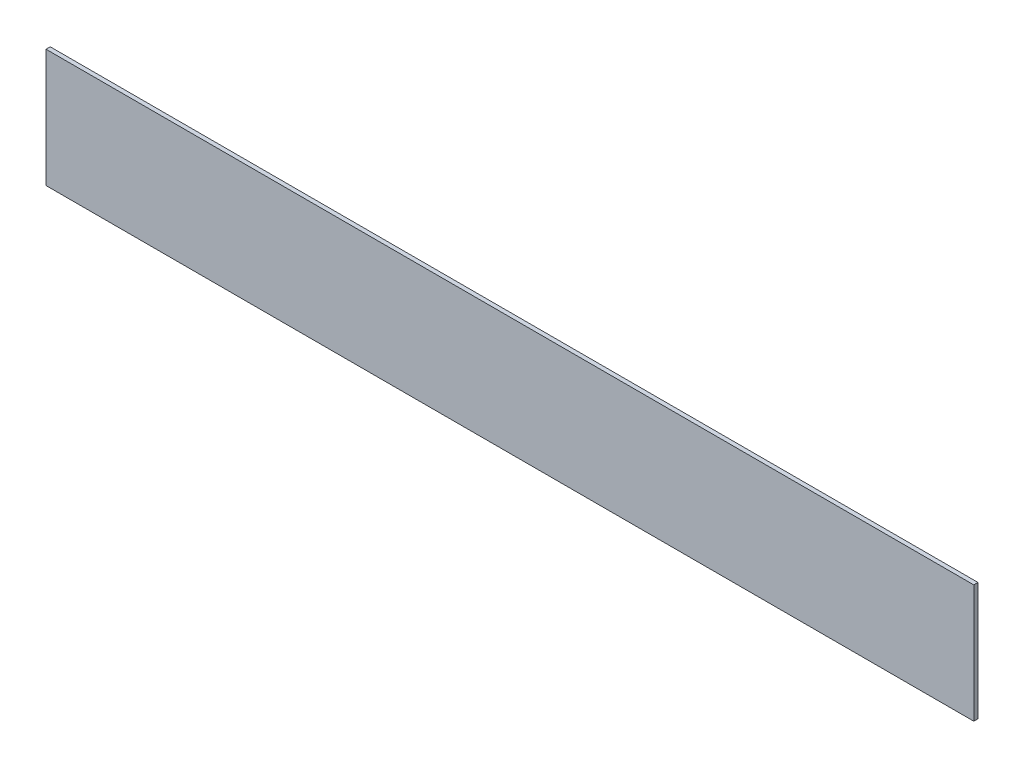
from build123d import *

# Parameters (mm, degrees)
SKETCH1_W           = 698.5
SKETCH1_H           = 88.9
BOSS_EXTRUDE2_DEPTH = 1.5875


with BuildPart() as part:
    # Sketch1 → Boss-Extrude2 (new, symmetric)
    with BuildSketch(Plane.XY):
        Rectangle(SKETCH1_W, SKETCH1_H)
    extrude(amount=BOSS_EXTRUDE2_DEPTH, both=True)


solid = part.part
